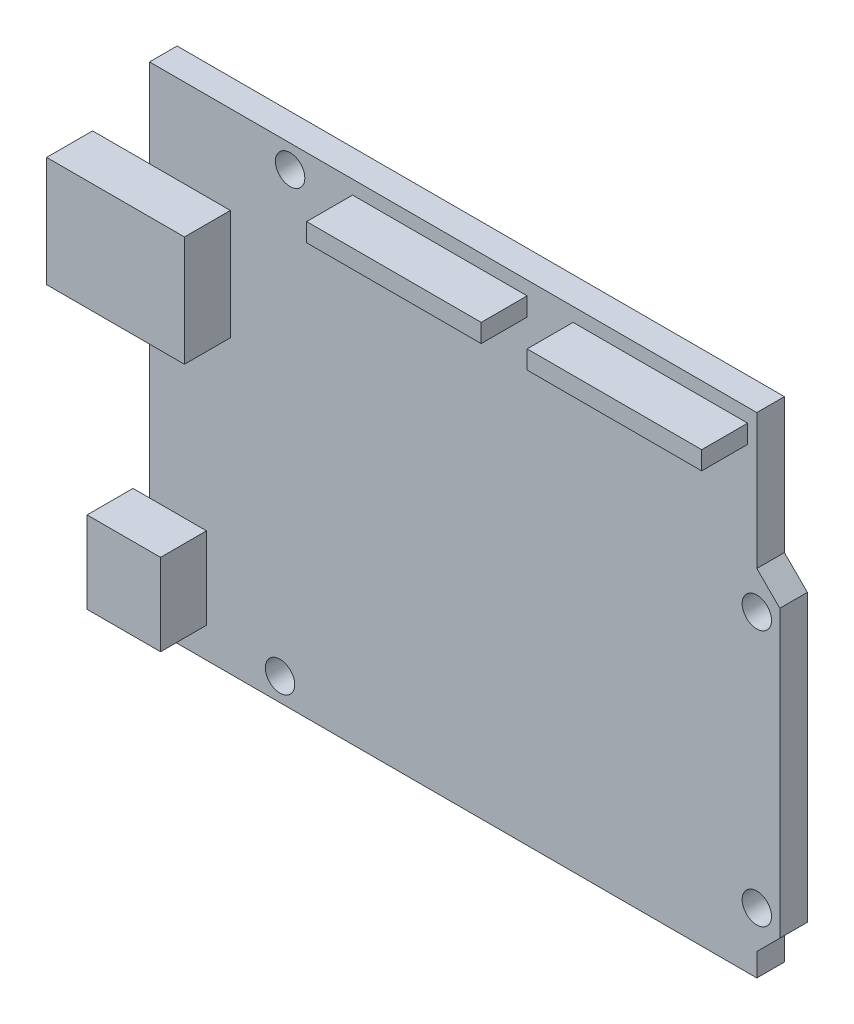
from build123d import *

# Parameters (mm, degrees)
CROQUIS1_R              = 1.6
SALIENTE_EXTRUIR1_DEPTH = 3
CROQUIS2_W              = 8.8
CROQUIS2_H              = 12
CROQUIS2_W_2            = 6.2
CROQUIS2_H_2            = 8.9
CROQUIS2_W_3            = 1.8
CROQUIS2_W_4            = 19
CROQUIS2_H_3            = 2
SALIENTE_EXTRUIR2_DEPTH = 5


with BuildPart() as part:
    # Croquis1 → Saliente-Extruir1 (new body)
    with BuildSketch(Plane.XY):
        Polygon((-33.05, 26.65), (-33.05, -26.65), (33.05, -26.65), (33.05, -24.15), (35.55, -21.65), (35.55, 9.45), (33.05, 11.95), (33.05, 26.65), align=None)
        with Locations((33.05, -20.05)):
            Circle(CROQUIS1_R, mode=Mode.SUBTRACT)
        with Locations((33.05, 7.85)):
            Circle(CROQUIS1_R, mode=Mode.SUBTRACT)
        with Locations((-18.85, -24.15)):
            Circle(CROQUIS1_R, mode=Mode.SUBTRACT)
        with Locations((-17.75, 24.15)):
            Circle(CROQUIS1_R, mode=Mode.SUBTRACT)
    extrude(amount=SALIENTE_EXTRUIR1_DEPTH)

    # Croquis2 → Saliente-Extruir2 (add)
    with BuildSketch(Plane.XY.offset(3)):
        with Locations((-28.65, 11.05)):
            Rectangle(CROQUIS2_W, CROQUIS2_H)
        with Locations((-29.95, -18.9)):
            Rectangle(CROQUIS2_W_2, CROQUIS2_H_2)
        with Locations((-36.15, 11.05)):
            Rectangle(CROQUIS2_W_2, CROQUIS2_H)
        with Locations((-33.95, -18.9)):
            Rectangle(CROQUIS2_W_3, CROQUIS2_H_2)
        with Locations((22.55, 24.15)):
            Rectangle(CROQUIS2_W_4, CROQUIS2_H_3)
        with Locations((-1.45, 24.15)):
            Rectangle(CROQUIS2_W_4, CROQUIS2_H_3)
    extrude(amount=SALIENTE_EXTRUIR2_DEPTH)


solid = part.part
